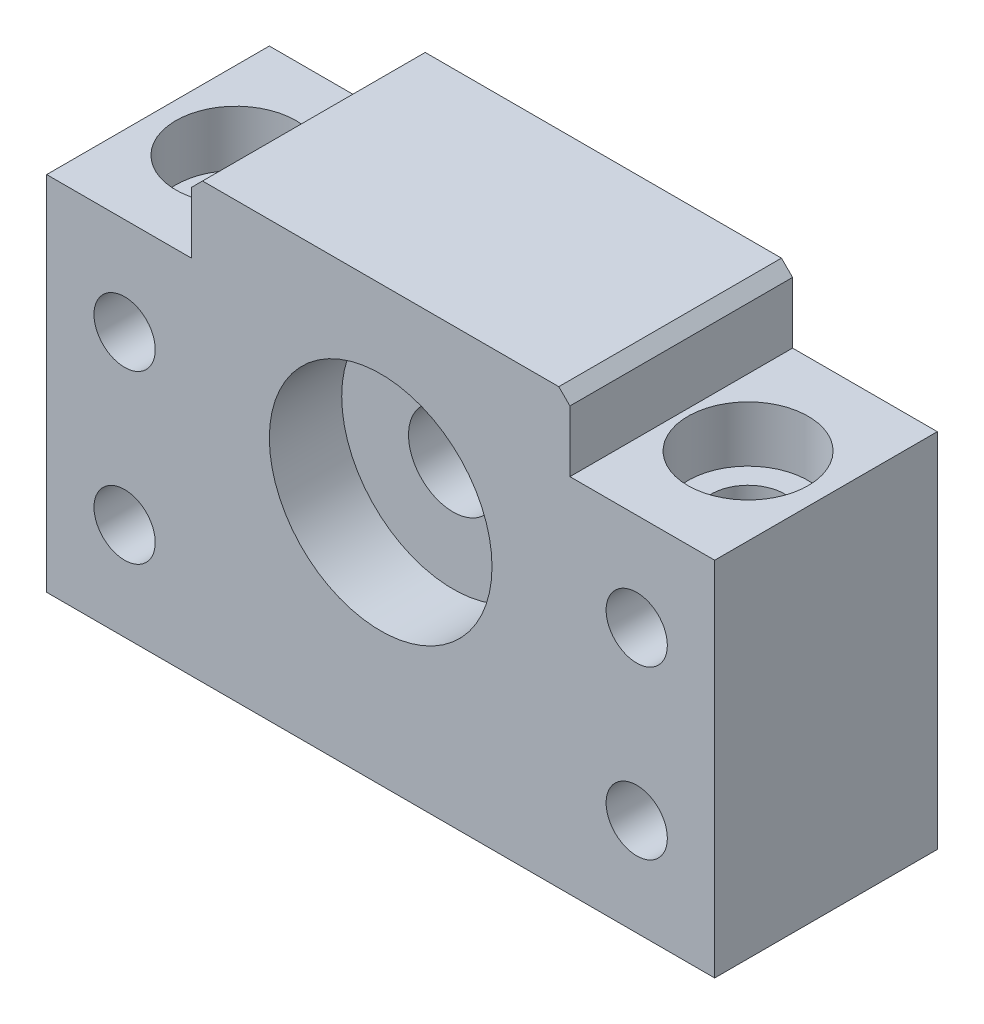
from build123d import *

# Parameters (mm, degrees)
AUFSATZ_LINEAR_AUSTRAGEN1_DEPTH = 20
SKIZZE4_R                       = 3.3
SCHNITT_LINEAR_AUSTRAGEN2_DEPTH = 50
SKIZZE5_R                       = 5.4
SCHNITT_LINEAR_AUSTRAGEN3_DEPTH = 5
SKIZZE6_R                       = 2.75
SCHNITT_LINEAR_AUSTRAGEN4_DEPTH = 50
SKIZZE7_R                       = 4
SCHNITT_LINEAR_AUSTRAGEN5_DEPTH = 50
SKIZZE8_R                       = 10
SCHNITT_LINEAR_AUSTRAGEN6_DEPTH = 6.5
SCHNITT_LINEAR_START            = -6.5
SKIZZE9_R                       = 10
SCHNITT_LINEAR_AUSTRAGEN7_DEPTH = 6.5


with BuildPart() as part:
    # Skizze1 → Aufsatz-Linear austragen1 (new body)
    with BuildSketch(Plane.XY):
        Polygon((-30, 0), (30, 0), (30, 32.5), (17, 32.5), (17, 38), (16, 39), (-16, 39), (-17, 38), (-17, 32.5), (-30, 32.5), align=None)
    extrude(amount=AUFSATZ_LINEAR_AUSTRAGEN1_DEPTH)

    # Skizze4 → Schnitt-Linear austragen2 (cut)
    with BuildSketch(Plane(origin=(0, 32.5, 0), x_dir=(1, 0, 0), z_dir=(0, 1, 0))):
        with Locations(Location((23, -10, 0), (0, 0, 270))):
            Circle(SKIZZE4_R)
        with Locations(Location((-23, -10, 0), (0, 0, 270))):
            Circle(SKIZZE4_R)
    extrude(amount=-SCHNITT_LINEAR_AUSTRAGEN2_DEPTH, mode=Mode.SUBTRACT)

    # Skizze5 → Schnitt-Linear austragen3 (cut)
    with BuildSketch(Plane(origin=(0, 32.5, 0), x_dir=(1, 0, 0), z_dir=(0, 1, 0))):
        with Locations(Location((23, -10, 0), (0, 0, 270))):
            Circle(SKIZZE5_R)
        with Locations(Location((-23, -10, 0), (0, 0, 90))):
            Circle(SKIZZE5_R)
    extrude(amount=-SCHNITT_LINEAR_AUSTRAGEN3_DEPTH, mode=Mode.SUBTRACT)

    # Skizze6 → Schnitt-Linear austragen4 (cut)
    with BuildSketch(Plane.XY.offset(20)):
        with Locations((23, 23.75)):
            Circle(SKIZZE6_R)
        with Locations((23, 8.75)):
            Circle(SKIZZE6_R)
        with Locations((-23, 23.75)):
            Circle(SKIZZE6_R)
        with Locations((-23, 8.75)):
            Circle(SKIZZE6_R)
    extrude(amount=-SCHNITT_LINEAR_AUSTRAGEN4_DEPTH, mode=Mode.SUBTRACT)

    # Skizze7 → Schnitt-Linear austragen5 (cut)
    with BuildSketch(Plane.XY.offset(20)):
        with Locations((0, 22)):
            Circle(SKIZZE7_R)
    extrude(amount=-SCHNITT_LINEAR_AUSTRAGEN5_DEPTH, mode=Mode.SUBTRACT)

    # Skizze8 → Schnitt-Linear austragen6 (cut)
    with BuildSketch(Plane.XY.offset(20)):
        with Locations((0, 22)):
            Circle(SKIZZE8_R)
    extrude(amount=-SCHNITT_LINEAR_AUSTRAGEN6_DEPTH, mode=Mode.SUBTRACT)

    # Skizze9 → Schnitt-Linear austragen7 (cut)
    with BuildSketch(Plane(origin=(0, 0, 0), x_dir=(-1, 0, 0), z_dir=(0, 0, -1)).offset(SCHNITT_LINEAR_START)):
        with Locations(Location((0, 22, 0), (0, 0, 180))):
            Circle(SKIZZE9_R)
    extrude(amount=SCHNITT_LINEAR_AUSTRAGEN7_DEPTH, mode=Mode.SUBTRACT)


solid = part.part
